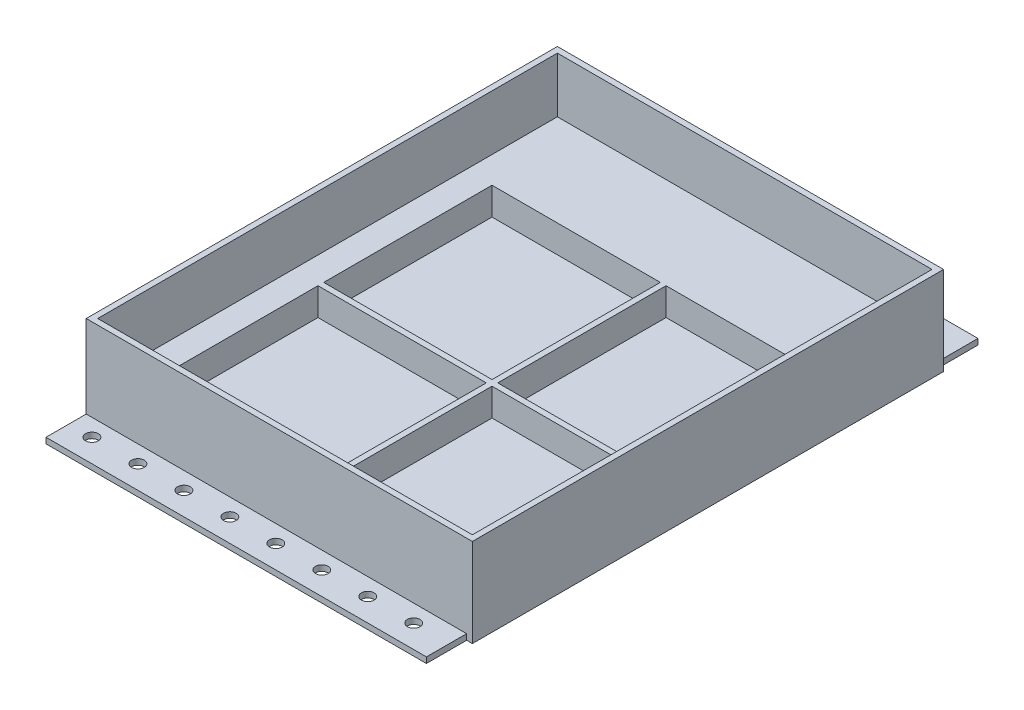
from build123d import *

# Parameters (mm, degrees)
SKETCH1_W           = 609.6
SKETCH1_H           = 304.8
SKETCH1_W_2         = 93
SKETCH1_H_2         = 93
BOSS_EXTRUDE1_DEPTH = 15.24
SKETCH2_W           = 609.6
SKETCH2_H           = 304.8
BOSS_EXTRUDE2_DEPTH = 3.175
SKETCH3_W           = 609.6
SKETCH3_H           = 304.8
SKETCH3_W_2         = 603.25
SKETCH3_H_2         = 254
BOSS_EXTRUDE3_DEPTH = 30.48
SKETCH4_OUTSIDE_W   = 748.262
SKETCH4_OUTSIDE_H   = 443.462
SKETCH4_OUTSIDE_W_2 = 609.6
SKETCH4_OUTSIDE_H_2 = 260.35
CUT_EXTRUDE1_DEPTH  = 45.72
SKETCH5_R           = 3.4925
CUT_EXTRUDE2_DEPTH  = 344.830071983
SKETCH6_W           = 327.140785269
SKETCH6_H           = 256.091806272
TEMPORARY_CUT_DEPTH = 430.914472374
SKETCH7_W           = 260.35
SKETCH7_H           = 48.895
BOSS_EXTRUDE4_DEPTH = 3.175


with BuildPart() as part:
    # Sketch1 → Boss-Extrude1 (new body)
    with BuildSketch(Plane(origin=(0, 0, 0), x_dir=(1, 0, 0), z_dir=(0, 1, 0))):
        Rectangle(SKETCH1_W, SKETCH1_H)
        with Locations((-48.0875, 29.7)):
            Rectangle(SKETCH1_W_2, SKETCH1_H_2, mode=Mode.SUBTRACT)
        with Locations((-144.2625, 29.7)):
            Rectangle(SKETCH1_W_2, SKETCH1_H_2, mode=Mode.SUBTRACT)
        with Locations((-144.2625, -66.475)):
            Rectangle(SKETCH1_W_2, SKETCH1_H_2, mode=Mode.SUBTRACT)
        with Locations((-48.0875, -66.475)):
            Rectangle(SKETCH1_W_2, SKETCH1_H_2, mode=Mode.SUBTRACT)
        with Locations((-240.4375, 29.7)):
            Rectangle(SKETCH1_W_2, SKETCH1_H_2, mode=Mode.SUBTRACT)
        with Locations((-240.4375, -66.475)):
            Rectangle(SKETCH1_W_2, SKETCH1_H_2, mode=Mode.SUBTRACT)
        with Locations((48.0875, 29.7)):
            Rectangle(SKETCH1_W_2, SKETCH1_H_2, mode=Mode.SUBTRACT)
        with Locations((48.0875, -66.475)):
            Rectangle(SKETCH1_W_2, SKETCH1_H_2, mode=Mode.SUBTRACT)
        with Locations((144.2625, 29.7)):
            Rectangle(SKETCH1_W_2, SKETCH1_H_2, mode=Mode.SUBTRACT)
        with Locations((144.2625, -66.475)):
            Rectangle(SKETCH1_W_2, SKETCH1_H_2, mode=Mode.SUBTRACT)
        with Locations((240.4375, 29.7)):
            Rectangle(SKETCH1_W_2, SKETCH1_H_2, mode=Mode.SUBTRACT)
        with Locations((240.4375, -66.475)):
            Rectangle(SKETCH1_W_2, SKETCH1_H_2, mode=Mode.SUBTRACT)
    extrude(amount=BOSS_EXTRUDE1_DEPTH)

    # Sketch2 → Boss-Extrude2 (add)
    with BuildSketch(Plane(origin=(0, 0, 0), x_dir=(-1, 0, 0), z_dir=(0, -1, 0))):
        Rectangle(SKETCH2_W, SKETCH2_H)
    extrude(amount=BOSS_EXTRUDE2_DEPTH)

    # Sketch3 → Boss-Extrude3 (add)
    with BuildSketch(Plane(origin=(0, 15.24, 0), x_dir=(1, 0, 0), z_dir=(0, 1, 0))):
        Rectangle(SKETCH3_W, SKETCH3_H)
        Rectangle(SKETCH3_W_2, SKETCH3_H_2, mode=Mode.SUBTRACT)
    extrude(amount=BOSS_EXTRUDE3_DEPTH)

    # Sketch4 outside → Cut-Extrude1 (cut)
    with BuildSketch(Plane(origin=(0, 45.72, 0), x_dir=(1, 0, 0), z_dir=(0, 1, 0))):
        Rectangle(SKETCH4_OUTSIDE_W, SKETCH4_OUTSIDE_H)
        Rectangle(SKETCH4_OUTSIDE_W_2, SKETCH4_OUTSIDE_H_2, mode=Mode.SUBTRACT)
    extrude(amount=-CUT_EXTRUDE1_DEPTH, mode=Mode.SUBTRACT)

    # Sketch5 → Cut-Extrude2 (cut, through all)
    with BuildSketch(Plane(origin=(0, 0, 0), x_dir=(1, 0, 0), z_dir=(0, 1, 0))):
        with Locations(Location((-292.1, -139.7, 0), (0, 0, 270))):
            Circle(SKETCH5_R)
        with Locations(Location((-266.7, -139.7, 0), (0, 0, 270))):
            Circle(SKETCH5_R)
        with Locations(Location((-241.3, -139.7, 0), (0, 0, 270))):
            Circle(SKETCH5_R)
        with Locations(Location((-215.9, -139.7, 0), (0, 0, 270))):
            Circle(SKETCH5_R)
        with Locations(Location((-190.5, -139.7, 0), (0, 0, 270))):
            Circle(SKETCH5_R)
        with Locations(Location((-165.1, -139.7, 0), (0, 0, 270))):
            Circle(SKETCH5_R)
        with Locations(Location((-139.7, -139.7, 0), (0, 0, 270))):
            Circle(SKETCH5_R)
        with Locations(Location((-114.3, -139.7, 0), (0, 0, 270))):
            Circle(SKETCH5_R)
        with Locations(Location((-88.9, -139.7, 0), (0, 0, 270))):
            Circle(SKETCH5_R)
        with Locations(Location((-63.5, -139.7, 0), (0, 0, 270))):
            Circle(SKETCH5_R)
        with Locations(Location((-38.1, -139.7, 0), (0, 0, 270))):
            Circle(SKETCH5_R)
        with Locations(Location((-12.7, -139.7, 0), (0, 0, 270))):
            Circle(SKETCH5_R)
        with Locations(Location((12.7, 139.7, 0), (0, 0, 270))):
            Circle(SKETCH5_R)
        with Locations(Location((38.1, 139.7, 0), (0, 0, 270))):
            Circle(SKETCH5_R)
        with Locations(Location((63.5, 139.7, 0), (0, 0, 270))):
            Circle(SKETCH5_R)
        with Locations(Location((88.9, 139.7, 0), (0, 0, 270))):
            Circle(SKETCH5_R)
        with Locations(Location((114.3, 139.7, 0), (0, 0, 270))):
            Circle(SKETCH5_R)
        with Locations(Location((139.7, 139.7, 0), (0, 0, 270))):
            Circle(SKETCH5_R)
        with Locations(Location((165.1, 139.7, 0), (0, 0, 270))):
            Circle(SKETCH5_R)
        with Locations(Location((190.5, 139.7, 0), (0, 0, 270))):
            Circle(SKETCH5_R)
        with Locations(Location((215.9, 139.7, 0), (0, 0, 270))):
            Circle(SKETCH5_R)
        with Locations(Location((241.3, 139.7, 0), (0, 0, 270))):
            Circle(SKETCH5_R)
        with Locations(Location((-292.1, 139.7, 0), (0, 0, 270))):
            Circle(SKETCH5_R)
        with Locations(Location((-266.7, 139.7, 0), (0, 0, 270))):
            Circle(SKETCH5_R)
        with Locations(Location((-241.3, 139.7, 0), (0, 0, 270))):
            Circle(SKETCH5_R)
        with Locations(Location((-215.9, 139.7, 0), (0, 0, 270))):
            Circle(SKETCH5_R)
        with Locations(Location((-190.5, 139.7, 0), (0, 0, 270))):
            Circle(SKETCH5_R)
        with Locations(Location((-165.1, 139.7, 0), (0, 0, 270))):
            Circle(SKETCH5_R)
        with Locations(Location((-139.7, 139.7, 0), (0, 0, 270))):
            Circle(SKETCH5_R)
        with Locations(Location((-114.3, 139.7, 0), (0, 0, 270))):
            Circle(SKETCH5_R)
        with Locations(Location((-88.9, 139.7, 0), (0, 0, 270))):
            Circle(SKETCH5_R)
        with Locations(Location((-63.5, 139.7, 0), (0, 0, 270))):
            Circle(SKETCH5_R)
        with Locations(Location((-38.1, 139.7, 0), (0, 0, 270))):
            Circle(SKETCH5_R)
        with Locations(Location((-12.7, 139.7, 0), (0, 0, 270))):
            Circle(SKETCH5_R)
        with Locations(Location((266.7, 139.7, 0), (0, 0, 270))):
            Circle(SKETCH5_R)
        with Locations(Location((292.1, 139.7, 0), (0, 0, 270))):
            Circle(SKETCH5_R)
        with Locations(Location((12.7, -139.7, 0), (0, 0, 270))):
            Circle(SKETCH5_R)
        with Locations(Location((38.1, -139.7, 0), (0, 0, 270))):
            Circle(SKETCH5_R)
        with Locations(Location((63.5, -139.7, 0), (0, 0, 270))):
            Circle(SKETCH5_R)
        with Locations(Location((88.9, -139.7, 0), (0, 0, 270))):
            Circle(SKETCH5_R)
        with Locations(Location((114.3, -139.7, 0), (0, 0, 270))):
            Circle(SKETCH5_R)
        with Locations(Location((139.7, -139.7, 0), (0, 0, 270))):
            Circle(SKETCH5_R)
        with Locations(Location((165.1, -139.7, 0), (0, 0, 270))):
            Circle(SKETCH5_R)
        with Locations(Location((190.5, -139.7, 0), (0, 0, 270))):
            Circle(SKETCH5_R)
        with Locations(Location((215.9, -139.7, 0), (0, 0, 270))):
            Circle(SKETCH5_R)
        with Locations(Location((241.3, -139.7, 0), (0, 0, 270))):
            Circle(SKETCH5_R)
        with Locations(Location((266.7, -139.7, 0), (0, 0, 270))):
            Circle(SKETCH5_R)
        with Locations(Location((292.1, -139.7, 0), (0, 0, 270))):
            Circle(SKETCH5_R)
    extrude(amount=-CUT_EXTRUDE2_DEPTH, mode=Mode.SUBTRACT)

    # Sketch6 → Temporary_Cut (cut, through all)
    with BuildSketch(Plane(origin=(-94.5875, 0, 0), x_dir=(0, 0, -1), z_dir=(1, 0, 0))):
        with Locations((-7.828616148, 44.910513642)):
            Rectangle(SKETCH6_W, SKETCH6_H)
    extrude(amount=TEMPORARY_CUT_DEPTH, mode=Mode.SUBTRACT)

    # Sketch7 → Boss-Extrude4 (add)
    with BuildSketch(Plane(origin=(-94.5875, 0, 0), x_dir=(0, 0, -1), z_dir=(1, 0, 0))):
        with Locations((0, 21.2725)):
            Rectangle(SKETCH7_W, SKETCH7_H)
    extrude(amount=BOSS_EXTRUDE4_DEPTH)


solid = part.part
